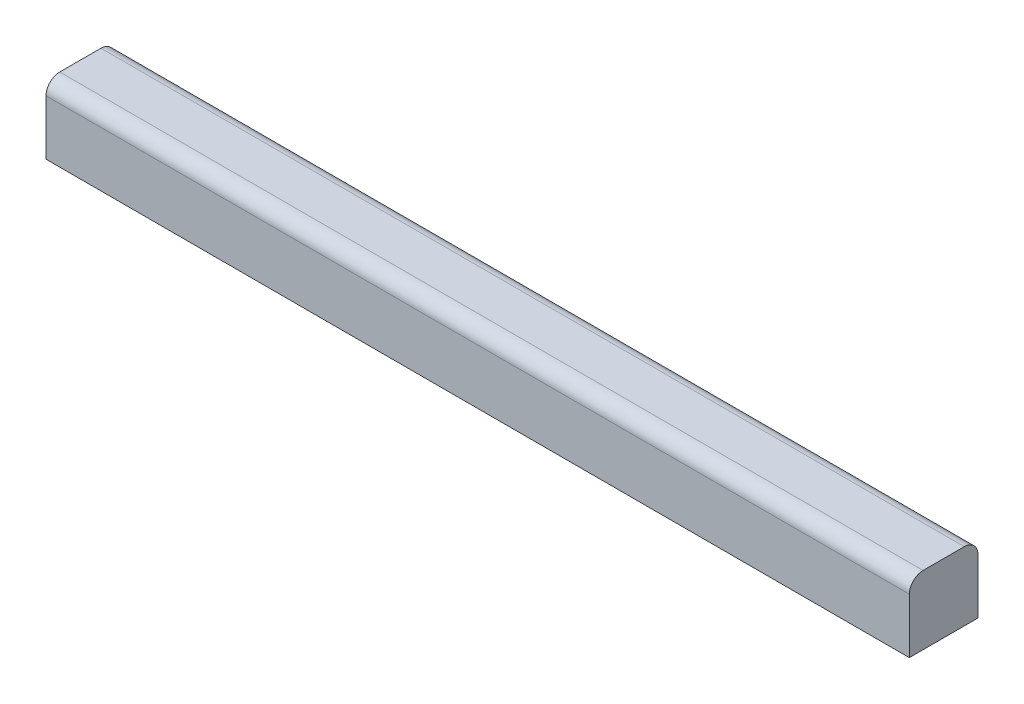
from build123d import *

# Parameters (mm, degrees)
SKETCH1_W           = 18.86
SKETCH1_H           = 1.5
BOSS_EXTRUDE2_DEPTH = 1.5
FILLET3_R           = 0.3


with BuildPart() as part:
    # Sketch1 → Boss-Extrude2 (new body)
    with BuildSketch(Plane.XY):
        with Locations((-12.269139785, 0.75)):
            Rectangle(SKETCH1_W, SKETCH1_H)
    extrude(amount=BOSS_EXTRUDE2_DEPTH)

    # Fillet3
    fillet3_edges = [part.edges().sort_by_distance(p)[0] for p in [
        (-12.269139785, 1.5, 0),
        (-12.269139785, 1.5, 1.5),
    ]]
    fillet(fillet3_edges, radius=FILLET3_R)


solid = part.part
